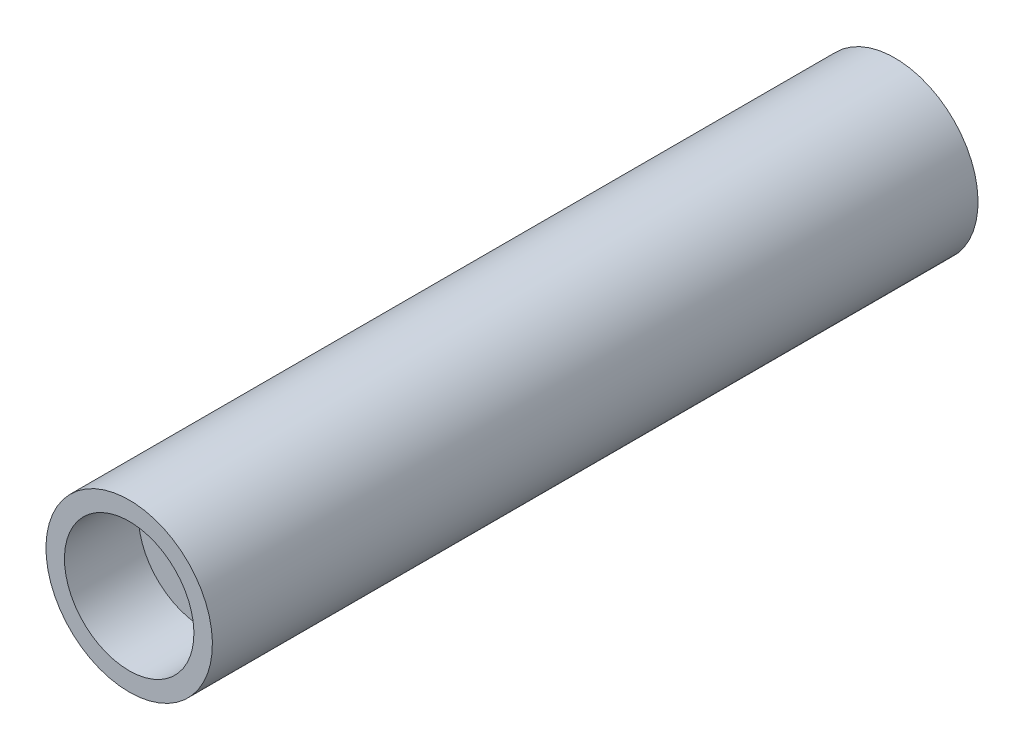
from build123d import *


with BuildPart() as part:
    # Sketch1 → Revolve1 (revolve)
    with BuildSketch(Plane(origin=(0, 0, 0), x_dir=(0, 0, -1), z_dir=(1, 0, 0)), mode=Mode.PRIVATE) as revolve1_sk:
        Polygon((16.7, 3.5), (20.7, 3.5), (20.7, 4.5), (-20.7, 4.5), (-20.7, 3.5), (-16.7, 3.5), (-16.7, 2), (16.7, 2), align=None)
    revolve(revolve1_sk.sketch.rotate(Axis((0, 0, 16.930047934), (0, 0, -1)), 180), axis=Axis((0, 0, 16.930047934), (0, 0, -1)))


solid = part.part
